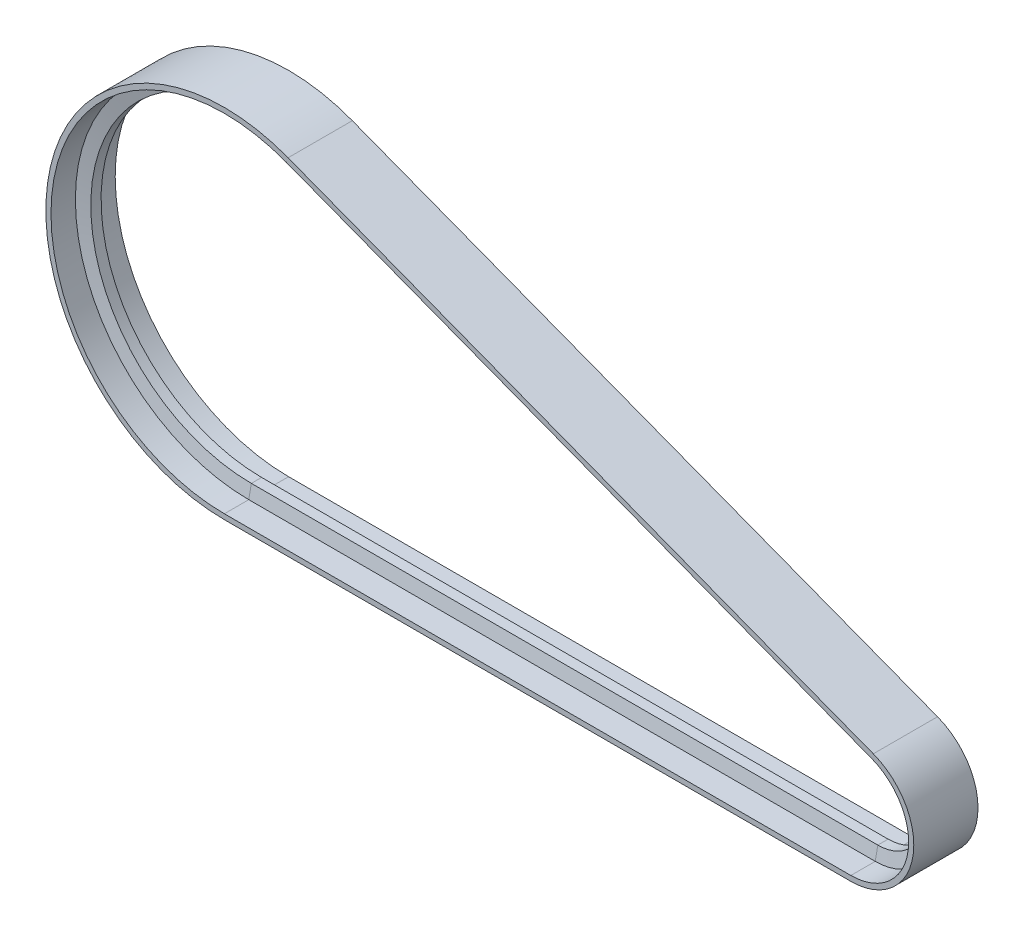
from build123d import *

# Parameters (mm, degrees)
EXTRUDE_THIN1_DEPTH = 12.5


with BuildPart() as part:
    # Sketch1 → Extrude-Thin1 (new, symmetric)
    with BuildSketch(Plane.XY):
        with BuildLine():
            Line((252.626703921, -22.113309703), (24.803089564, 64.923468392))
            ThreePointArc((24.803089564, 64.923468392), (-68.346291243, 12.610887097), (0, -69.5))
            Line((0, -69.5), (243.883168751, -69.5))
            ThreePointArc((243.883168751, -69.5), (267.976465664, -49.445564516), (252.626703921, -22.113309703))
        make_face()
        with BuildLine():
            Line((251.912945948, -23.981610952), (24.089331591, 63.055167144))
            ThreePointArc((24.089331591, 63.055167144), (-66.379491495, 12.247983871), (0, -67.5))
            Line((0, -67.5), (243.883168751, -67.5))
            ThreePointArc((243.883168751, -67.5), (266.009665916, -49.08266129), (251.912945948, -23.981610952))
        make_face(mode=Mode.SUBTRACT)
    extrude(amount=EXTRUDE_THIN1_DEPTH, both=True)

    # Sweep1: sweep along a path in Sketch1<3>
    with BuildLine(Plane.XY) as sweep1_path:
        Line((0, -67.5), (243.883168751, -67.5))
        ThreePointArc((243.883168751, -67.5), (266.009665916, -49.08266129), (251.912945948, -23.981610952))
        Line((251.912945948, -23.981610952), (24.089331591, 63.055167144))
        ThreePointArc((24.089331591, 63.055167144), (-66.379491495, 12.247983871), (0, -67.5))
    # Sketch2 → Sweep1 (sweep)
    with BuildSketch(Plane(origin=(0, 0, 0), x_dir=(0, 0, -1), z_dir=(1, 0, 0))):
        Polygon((-3, -67.5), (-2, -62.5), (2, -62.5), (3, -67.5), align=None)
    sweep(path=sweep1_path.line)


solid = part.part
